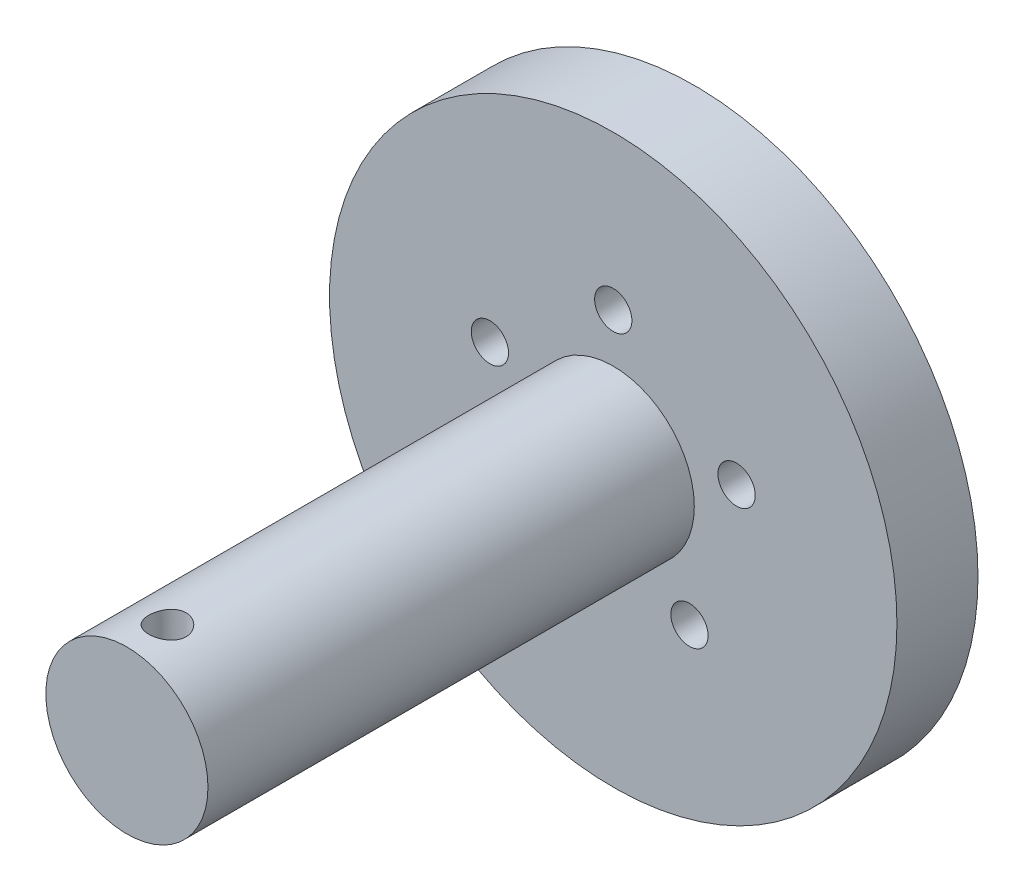
from build123d import *

# Parameters (mm, degrees)
SKETCH1_R           = 44.45
SKETCH1_R_2         = 2.921
BOSS_EXTRUDE1_DEPTH = 12.7
SKETCH2_R           = 12.7
BOSS_EXTRUDE2_DEPTH = 76.2
CUT_EXTRUDE1_REACH  = 116.652
SKETCH4_R           = 2.921


with BuildPart() as part:
    # Sketch1 → Boss-Extrude1 (new body)
    with BuildSketch(Plane.XY):
        Circle(SKETCH1_R)
        with Locations((0, 20.32)):
            Circle(SKETCH1_R_2, mode=Mode.SUBTRACT)
        with Locations((19.325468411, 6.279225326)):
            Circle(SKETCH1_R_2, mode=Mode.SUBTRACT)
        with Locations((11.943796327, -16.439225326)):
            Circle(SKETCH1_R_2, mode=Mode.SUBTRACT)
        with Locations((-11.943796327, -16.439225326)):
            Circle(SKETCH1_R_2, mode=Mode.SUBTRACT)
        with Locations((-19.325468411, 6.279225326)):
            Circle(SKETCH1_R_2, mode=Mode.SUBTRACT)
    extrude(amount=BOSS_EXTRUDE1_DEPTH)

    # Sketch2 → Boss-Extrude2 (add)
    with BuildSketch(Plane.XY.offset(12.7)):
        with Locations(Location((0, 0, 0), (0, 0, 180))):
            Circle(SKETCH2_R)
    extrude(amount=BOSS_EXTRUDE2_DEPTH)

    # Sketch4 → Cut-Extrude1 (cut, up to next)
    with BuildSketch(Plane(origin=(0, -12.7, 0), x_dir=(-1, 0, 0), z_dir=(0, -1, 0)), mode=Mode.PRIVATE) as cut_extrude1_sk1:
        with Locations(Location((0, -82.55, 0), (0, 0, 90))):
            Circle(SKETCH4_R)
    cut_extrude1_tool1 = extrude(cut_extrude1_sk1.sketch, amount=-CUT_EXTRUDE1_REACH, mode=Mode.PRIVATE) & part.part
    add(cut_extrude1_tool1.solids().sort_by_distance((0, -12.7, 82.55))[0], mode=Mode.SUBTRACT)


solid = part.part
